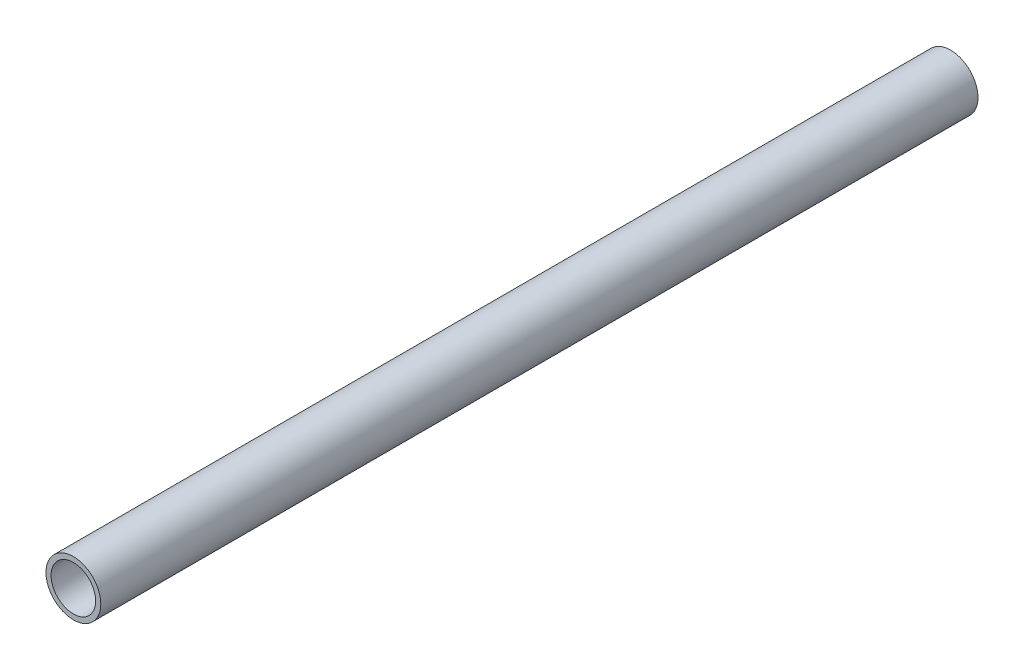
from build123d import *

# Parameters (mm, degrees)
BOSS_EXTRUDE1_DEPTH      = 76.2
BOSS_EXTRUDE1_DEPTH_BACK = 76.2
SKETCH3_R                = 4.7625
SKETCH3_R_2              = 3.8735


with BuildPart() as part:
    # Sketch3 → Boss-Extrude1 (new, two sides: drawn at the far end of the back side and taken through both)
    with BuildSketch(Plane.XY.offset(-BOSS_EXTRUDE1_DEPTH_BACK)):
        Circle(SKETCH3_R)
        Circle(SKETCH3_R_2, mode=Mode.SUBTRACT)
    extrude(amount=BOSS_EXTRUDE1_DEPTH + BOSS_EXTRUDE1_DEPTH_BACK)


solid = part.part
